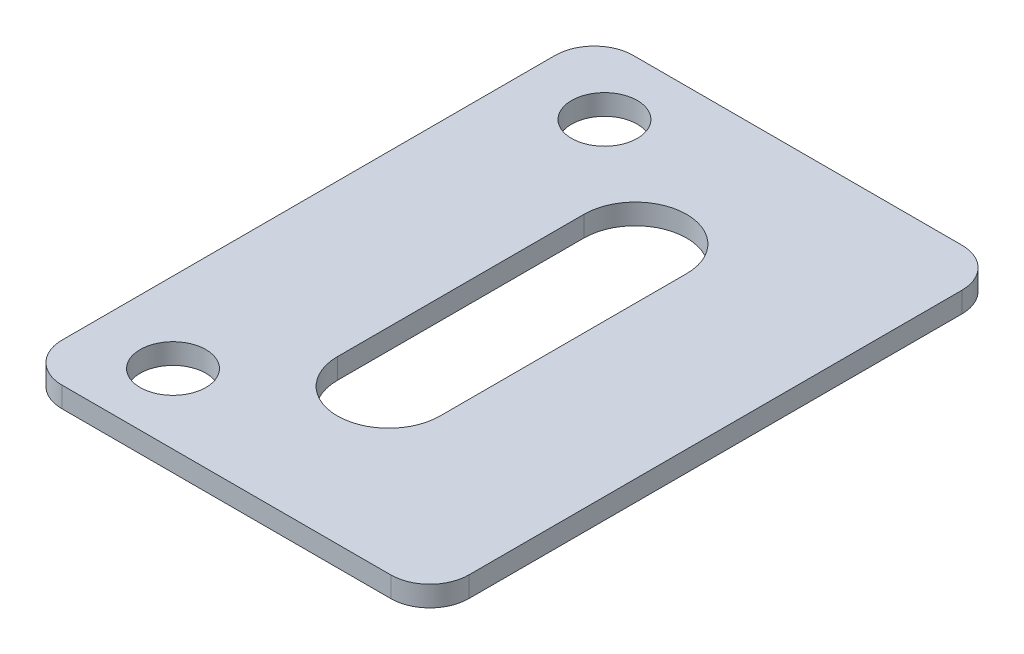
from build123d import *

# Parameters (mm, degrees)
SKETCH1_W           = 20
SKETCH1_H           = 28
BOSS_EXTRUDE1_DEPTH = 1
FILLET1_R           = 2
SKETCH2_W           = 25.473591578
SKETCH2_H           = 30.562755328
CUT_EXTRUDE1_DEPTH  = 18.23368794
SKETCH3_R           = 1.6
CUT_EXTRUDE2_DEPTH  = 18.094443542
CUT_EXTRUDE3_DEPTH  = 10


with BuildPart() as part:
    # Sketch1 → Boss-Extrude1 (new body)
    with BuildSketch(Plane(origin=(0, 0, 0), x_dir=(1, 0, 0), z_dir=(0, 1, 0))):
        Rectangle(SKETCH1_W, SKETCH1_H)
    extrude(amount=BOSS_EXTRUDE1_DEPTH)

    # Fillet1
    fillet1_edges = [part.edges().sort_by_distance(p)[0] for p in [
        (10, 0.5, 14),
        (-10, 0.5, 14),
        (-10, 0.5, -14),
        (10, 0.5, -14),
    ]]
    fillet(fillet1_edges, radius=FILLET1_R)

    # Sketch2 → Cut-Extrude1 (cut, through all)
    with BuildSketch(Plane(origin=(0, 1, 0), x_dir=(1, 0, 0), z_dir=(0, 1, 0))):
        Rectangle(SKETCH2_W, SKETCH2_H)
        with BuildLine():
            Line((-8, -13.9), (8, -13.9))
            ThreePointArc((8, -13.9), (9.343502884, -13.343502884), (9.9, -12))
            Line((9.9, -12), (9.9, 12))
            ThreePointArc((9.9, 12), (9.343502884, 13.343502884), (8, 13.9))
            Line((8, 13.9), (-8, 13.9))
            ThreePointArc((-8, 13.9), (-9.343502884, 13.343502884), (-9.9, 12))
            Line((-9.9, 12), (-9.9, -12))
            ThreePointArc((-9.9, -12), (-9.343502884, -13.343502884), (-8, -13.9))
        make_face(mode=Mode.SUBTRACT)
    extrude(amount=-CUT_EXTRUDE1_DEPTH, mode=Mode.SUBTRACT)

    # Sketch3 → Cut-Extrude2 (cut, through all)
    with BuildSketch(Plane(origin=(0, 0, 0), x_dir=(-1, 0, 0), z_dir=(0, -1, 0))):
        with Locations(Location((6, -10.5, 0), (0, 0, 90))):
            Circle(SKETCH3_R)
        with Locations(Location((6, 10.5, 0), (0, 0, 90))):
            Circle(SKETCH3_R)
    extrude(amount=-CUT_EXTRUDE2_DEPTH, mode=Mode.SUBTRACT)

    # Sketch4 → Cut-Extrude3 (cut)
    with BuildSketch(Plane(origin=(0, 1, 0), x_dir=(1, 0, 0), z_dir=(0, 1, 0))):
        with BuildLine():
            Line((2.5, 6), (2.5, -6))
            ThreePointArc((2.5, -6), (0, -8.5), (-2.5, -6))
            Line((-2.5, -6), (-2.5, 6))
            ThreePointArc((-2.5, 6), (0, 8.5), (2.5, 6))
        make_face()
    extrude(amount=-CUT_EXTRUDE3_DEPTH, mode=Mode.SUBTRACT)


solid = part.part
